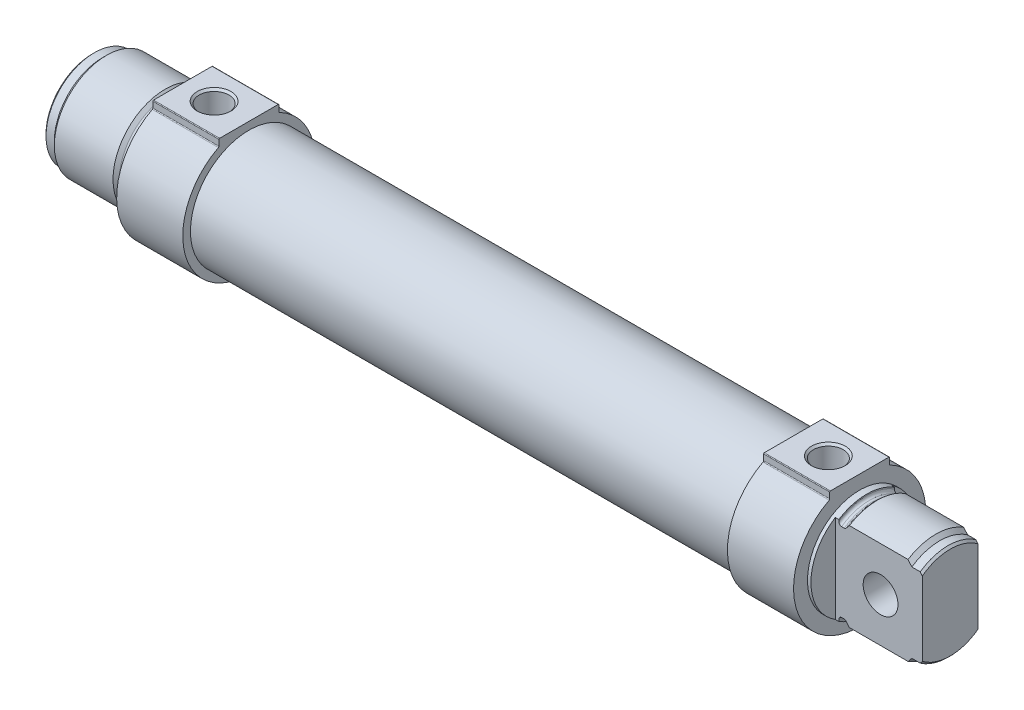
from build123d import *

# Parameters (mm, degrees)
AUFSATZ_LINEAR_AUSTRAGEN1_DEPTH      = 19
SKIZZE3_W                            = 156.5
SKIZZE3_H                            = 16.8
AUFSATZ_LINEAR_AUSTRAGEN2_DEPTH      = 19
SCHNITT_LINEAR_AUSTRAGEN1_DEPTH      = 19
SCHNITT_LINEAR_AUSTRAGEN1_DEPTH_BACK = 19
BOHRUNG1_D                           = 10
BOHRUNG2_D                           = 8.566
BOHRUNG2_DEPTH                       = 8.5
BOHRUNG2_CSINK_D                     = 9.728
BOHRUNG2_CSINK_ANGLE                 = 90
BOHRUNG3_D                           = 8.566
BOHRUNG3_DEPTH                       = 8.5
BOHRUNG3_CSINK_D                     = 9.728
BOHRUNG3_CSINK_ANGLE                 = 90


with BuildPart() as part:
    # Skizze1 → Rotation1 (revolve)
    with BuildSketch(Plane.XY):
        with BuildLine():
            Line((0, 0), (0, 13.3))
            Line((0, 13.3), (0.6, 13.9))
            Line((0.6, 13.9), (3, 13.9))
            Line((3, 13.9), (4.1, 15))
            Line((4.1, 15), (20.95, 15))
            Line((20.95, 15), (21.865685425, 14.084314575))
            ThreePointArc((21.865685425, 14.084314575), (22.125224104, 13.910896374), (22.43137085, 13.85))
            Line((22.43137085, 13.85), (23.2, 13.85))
            ThreePointArc((23.2, 13.85), (23.765685425, 14.084314575), (24, 14.65))
            Line((24, 14.65), (24, 15))
            Line((24, 15), (26, 15))
            Line((26, 15), (26, 0))
            Line((26, 0), (0, 0))
        make_face()
    revolve(axis=Axis((26, 0, 0), (-1, 0, 0)))

    # Skizze2 → Aufsatz-Linear austragen1 (add)
    with BuildSketch(Plane(origin=(26, 0, 0), x_dir=(0, 0, -1), z_dir=(1, 0, 0))):
        with BuildLine():
            Line((8.6, 17.125419703), (8.6, 18.8))
            ThreePointArc((8.6, 18.8), (8.541421356, 18.941421356), (8.4, 19))
            Line((8.4, 19), (-8.4, 19))
            ThreePointArc((-8.4, 19), (-8.541421356, 18.941421356), (-8.6, 18.8))
            Line((-8.6, 18.8), (-8.6, 17.125419703))
            ThreePointArc((-8.6, 17.125419703), (-8.643579842, 16.969699754), (-8.761658017, 16.859221476))
            ThreePointArc((-8.761658017, 16.859221476), (-8e-09, -19), (8.761658031, 16.859221469))
            ThreePointArc((8.761658031, 16.859221469), (8.643579846, 16.969699747), (8.6, 17.125419703))
        make_face()
    extrude(amount=AUFSATZ_LINEAR_AUSTRAGEN1_DEPTH)

    # Skizze3 → Rotation2 (revolve)
    with BuildSketch(Plane.XY):
        with Locations((123.25, 8.4)):
            Rectangle(SKIZZE3_W, SKIZZE3_H)
    revolve(axis=Axis((201.5, 0, 0), (-1, 0, 0)))

    # Skizze4 → Aufsatz-Linear austragen2 (add)
    with BuildSketch(Plane(origin=(201.5, 0, 0), x_dir=(0, 0, -1), z_dir=(1, 0, 0))):
        with BuildLine():
            Line((8.6, 17.125419703), (8.6, 18.8))
            ThreePointArc((8.6, 18.8), (8.541421356, 18.941421356), (8.4, 19))
            Line((8.4, 19), (-8.4, 19))
            ThreePointArc((-8.4, 19), (-8.541421356, 18.941421356), (-8.6, 18.8))
            Line((-8.6, 18.8), (-8.6, 17.125419703))
            ThreePointArc((-8.6, 17.125419703), (-8.643579842, 16.969699754), (-8.761658017, 16.859221476))
            ThreePointArc((-8.761658017, 16.859221476), (-8e-09, -19), (8.761658031, 16.859221469))
            ThreePointArc((8.761658031, 16.859221469), (8.643579846, 16.969699747), (8.6, 17.125419703))
        make_face()
    extrude(amount=AUFSATZ_LINEAR_AUSTRAGEN2_DEPTH)

    # Skizze5 → Rotation3 (revolve)
    with BuildSketch(Plane.XY):
        with BuildLine():
            Line((220.5, 0), (220.5, 15))
            Line((220.5, 15), (222.5, 15))
            Line((222.5, 15), (222.5, 14.65))
            ThreePointArc((222.5, 14.65), (222.734314575, 14.084314575), (223.3, 13.85))
            Line((223.3, 13.85), (224.06862915, 13.85))
            ThreePointArc((224.06862915, 13.85), (224.374775896, 13.910896374), (224.634314575, 14.084314575))
            Line((224.634314575, 14.084314575), (225.55, 15))
            Line((225.55, 15), (242.4, 15))
            Line((242.4, 15), (243.5, 13.9))
            Line((243.5, 13.9), (245.9, 13.9))
            Line((245.9, 13.9), (246.5, 13.3))
            Line((246.5, 13.3), (246.5, 0))
            Line((246.5, 0), (220.5, 0))
        make_face()
    revolve(axis=Axis((246.5, 0, 0), (-1, 0, 0)))

    # Skizze6 → Schnitt-Linear austragen1 (cut, two sides: drawn at the far end of the back side and taken through both)
    with BuildSketch(Plane(origin=(0, 0, 0), x_dir=(1, 0, 0), z_dir=(0, 1, 0)).offset(-SCHNITT_LINEAR_AUSTRAGEN1_DEPTH_BACK)):
        Polygon((221.5, 24), (221.5, 8), (246.5, 8), (246.5, -8), (221.5, -8), (221.5, -24), (262.5, -24), (262.5, 24), align=None)
    extrude(amount=SCHNITT_LINEAR_AUSTRAGEN1_DEPTH + SCHNITT_LINEAR_AUSTRAGEN1_DEPTH_BACK, mode=Mode.SUBTRACT)

    # Bohrung1 (through all)
    with Locations(Plane(origin=(0, 0, -8), x_dir=(-1, 0, 0), z_dir=(0, 0, -1))):
        with Locations((-234.5, 0)):
            Hole(BOHRUNG1_D / 2)

    # Bohrung2
    with Locations(Plane(origin=(0, 19, 0), x_dir=(1, 0, 0), z_dir=(0, 1, 0))):
        with Locations((35, 0)):
            CounterSinkHole(BOHRUNG2_D / 2, BOHRUNG2_CSINK_D / 2, depth=BOHRUNG2_DEPTH, counter_sink_angle=BOHRUNG2_CSINK_ANGLE)

    # Bohrung3
    with Locations(Plane(origin=(0, 19, 0), x_dir=(1, 0, 0), z_dir=(0, 1, 0))):
        with Locations((211.5, 0)):
            CounterSinkHole(BOHRUNG3_D / 2, BOHRUNG3_CSINK_D / 2, depth=BOHRUNG3_DEPTH, counter_sink_angle=BOHRUNG3_CSINK_ANGLE)

    # Skizze13 → Schnitt-Rotation1 (revolve, cut)
    with BuildSketch(Plane.XY):
        Polygon((-8, 0), (-8, 6), (57, 6), (57, 16), (190, 16), (190, 0), align=None)
    revolve(axis=Axis((190, 0, 0), (-1, 0, 0)), mode=Mode.SUBTRACT)


solid = part.part
